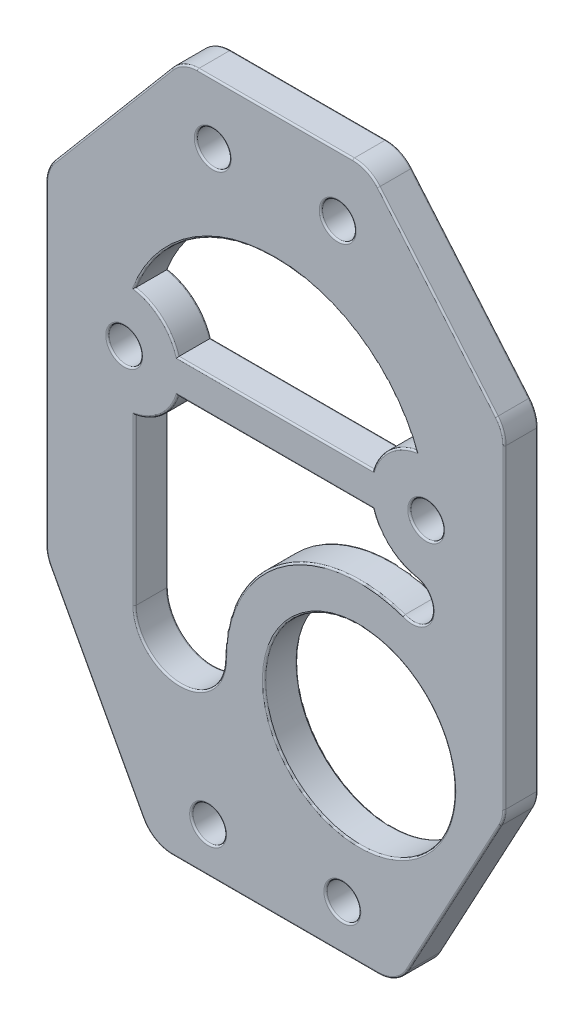
from build123d import *

# Parameters (mm, degrees)
SKETCH1_R           = 1.5
SKETCH1_R_2         = 8.5
BOSS_EXTRUDE1_DEPTH = 1.5
FILLET1_R           = 3
FILLET2_R           = 0.15


with BuildPart() as part:
    # Sketch1 → Boss-Extrude1 (new, symmetric)
    with BuildSketch(Plane.XY):
        Polygon((11, 0), (-11, 0), (-20.5, 17.599715907), (-20.5, 47.599715907), (-8.336352601, 62), (8.336352601, 62), (20.5, 47.599715907), (20.5, 17.599715907), align=None)
        with Locations((-5.586352601, 56.529411765)):
            Circle(SKETCH1_R, mode=Mode.SUBTRACT)
        with Locations((-13.5, 37.299715907)):
            Circle(SKETCH1_R, mode=Mode.SUBTRACT)
        with Locations((-6, 4)):
            Circle(SKETCH1_R, mode=Mode.SUBTRACT)
        with Locations(Location((5.586352601, 56.529411765, 0), (0, 0, 180))):
            Circle(SKETCH1_R, mode=Mode.SUBTRACT)
        with Locations(Location((6, 4, 0), (0, 0, 180))):
            Circle(SKETCH1_R, mode=Mode.SUBTRACT)
        with Locations(Location((13.5, 37.299715907, 0), (0, 0, 180))):
            Circle(SKETCH1_R, mode=Mode.SUBTRACT)
        with Locations((7.5, 17.599715907)):
            Circle(SKETCH1_R_2, mode=Mode.SUBTRACT)
        with BuildLine():
            Line((-8.730303993, 38.799715907), (8.730303993, 38.799715907))
            ThreePointArc((8.730303993, 38.799715907), (10.179901517, 41.038291312), (12.574074074, 42.213234115))
            ThreePointArc((12.574074074, 42.213234115), (0, 50.799715907), (-12.574074074, 42.213234115))
            ThreePointArc((-12.574074074, 42.213234115), (-10.179901517, 41.038291312), (-8.730303993, 38.799715907))
        make_face(mode=Mode.SUBTRACT)
        with BuildLine():
            Line((-8.730303993, 35.799715907), (8.730303993, 35.799715907))
            ThreePointArc((8.730303993, 35.799715907), (10.179901517, 33.561140502), (12.574074074, 32.386197699))
            ThreePointArc((12.574074074, 32.386197699), (13.981038563, 30.039310168), (11.484645167, 28.918841443))
            ThreePointArc((11.484645167, 28.918841443), (0.565151119, 27.392972311), (-4.5, 17.599715907))
            ThreePointArc((-4.5, 17.599715907), (-8.537037037, 13.56267887), (-12.574074074, 17.599715907))
            Line((-12.574074074, 17.599715907), (-12.574074074, 32.386197699))
            ThreePointArc((-12.574074074, 32.386197699), (-10.179901517, 33.561140502), (-8.730303993, 35.799715907))
        make_face(mode=Mode.SUBTRACT)
    extrude(amount=BOSS_EXTRUDE1_DEPTH, both=True)

    # Fillet1
    fillet1_edges = [part.edges().sort_by_distance(p)[0] for p in [
        (-20.5, 17.599715907, 0),
        (-20.5, 47.599715907, 0),
        (-8.336352601, 62, 0),
        (8.336352601, 62, 0),
        (20.5, 47.599715907, 0),
        (20.5, 17.599715907, 0),
        (11, 0, 0),
        (-11, 0, 0),
    ]]
    fillet(fillet1_edges, radius=FILLET1_R)

    # Fillet2
    fillet2_edges = [part.edges().sort_by_distance(p)[0] for p in [
        (0, 0, -1.5),
        (0, 0, 1.5),
        (10.747240997, 0.423665394, -1.5),
        (-10.747240997, 0.423665394, -1.5),
        (15.995056577, 9.253850179, -1.5),
        (-15.995056577, 9.253850179, -1.5),
        (20.408596926, 17.622809943, -1.5),
        (-20.408596926, 17.622809943, -1.5),
        (20.5, 32.429976848, -1.5),
        (-20.5, 32.429976848, -1.5),
        (20.317398375, 47.532916424, -1.5),
        (-20.317398375, 47.532916424, -1.5),
        (14.513517381, 54.686985671, -1.5),
        (-14.513517381, 54.686985671, -1.5),
        (8.206802597, 61.720990353, -1.5),
        (-8.206802597, 61.720990353, -1.5),
        (0, 62, -1.5),
        (-7.086352601, 56.529411765, -1.5),
        (-15, 37.299715907, -1.5),
        (-7.5, 4, -1.5),
        (7.086352601, 56.529411765, -1.5),
        (7.5, 4, -1.5),
        (15, 37.299715907, -1.5),
        (-1, 17.599715907, -1.5),
        (0, 50.799715907, -1.5),
        (-10.179901517, 41.038291312, -1.5),
        (0, 38.799715907, -1.5),
        (10.179901517, 41.038291312, -1.5),
        (-10.179901517, 33.561140502, -1.5),
        (-12.574074074, 24.992956803, -1.5),
        (-8.537037037, 13.56267887, -1.5),
        (0.565151119, 27.392972311, -1.5),
        (13.981038563, 30.039310168, -1.5),
        (10.179901517, 33.561140502, -1.5),
        (0, 35.799715907, -1.5),
        (10.747240997, 0.423665394, 1.5),
        (-10.747240997, 0.423665394, 1.5),
        (15.995056577, 9.253850179, 1.5),
        (-15.995056577, 9.253850179, 1.5),
        (20.408596926, 17.622809943, 1.5),
        (-20.408596926, 17.622809943, 1.5),
        (20.5, 32.429976848, 1.5),
        (-20.5, 32.429976848, 1.5),
        (20.317398375, 47.532916424, 1.5),
        (-20.317398375, 47.532916424, 1.5),
        (14.513517381, 54.686985671, 1.5),
        (-14.513517381, 54.686985671, 1.5),
        (8.206802597, 61.720990353, 1.5),
        (-8.206802597, 61.720990353, 1.5),
        (0, 62, 1.5),
        (-7.086352601, 56.529411765, 1.5),
        (-15, 37.299715907, 1.5),
        (-7.5, 4, 1.5),
        (7.086352601, 56.529411765, 1.5),
        (7.5, 4, 1.5),
        (15, 37.299715907, 1.5),
        (-1, 17.599715907, 1.5),
        (0, 50.799715907, 1.5),
        (-10.179901517, 41.038291312, 1.5),
        (0, 38.799715907, 1.5),
        (10.179901517, 41.038291312, 1.5),
        (-10.179901517, 33.561140502, 1.5),
        (-12.574074074, 24.992956803, 1.5),
        (-8.537037037, 13.56267887, 1.5),
        (0.565151119, 27.392972311, 1.5),
        (13.981038563, 30.039310168, 1.5),
        (10.179901517, 33.561140502, 1.5),
        (0, 35.799715907, 1.5),
    ]]
    fillet(fillet2_edges, radius=FILLET2_R)


solid = part.part
